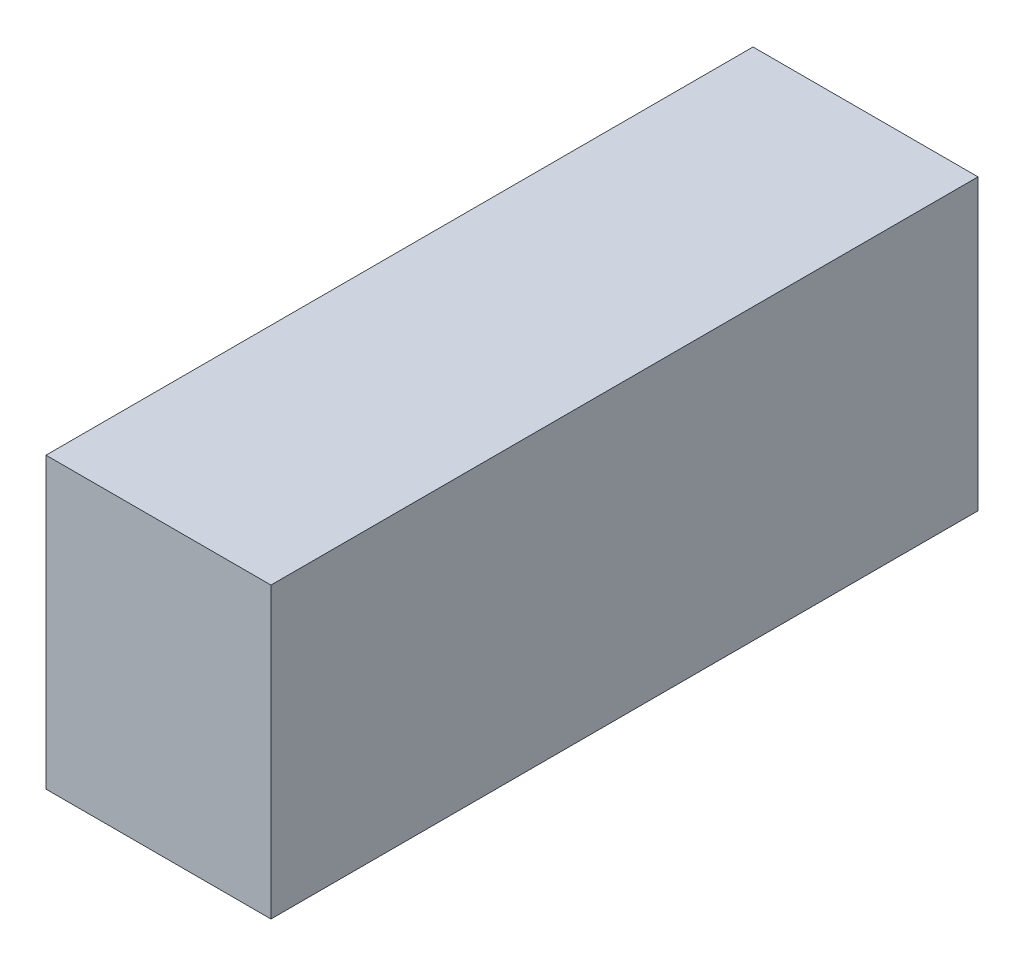
from build123d import *

# Parameters (mm, degrees)
SKETCH1_W           = 44.45
SKETCH1_H           = 139.7
BOSS_EXTRUDE1_DEPTH = 57.15


with BuildPart() as part:
    # Sketch1 → Boss-Extrude1 (new body)
    with BuildSketch(Plane(origin=(0, 0, 0), x_dir=(1, 0, 0), z_dir=(0, 1, 0))):
        Rectangle(SKETCH1_W, SKETCH1_H)
    extrude(amount=BOSS_EXTRUDE1_DEPTH)


solid = part.part
